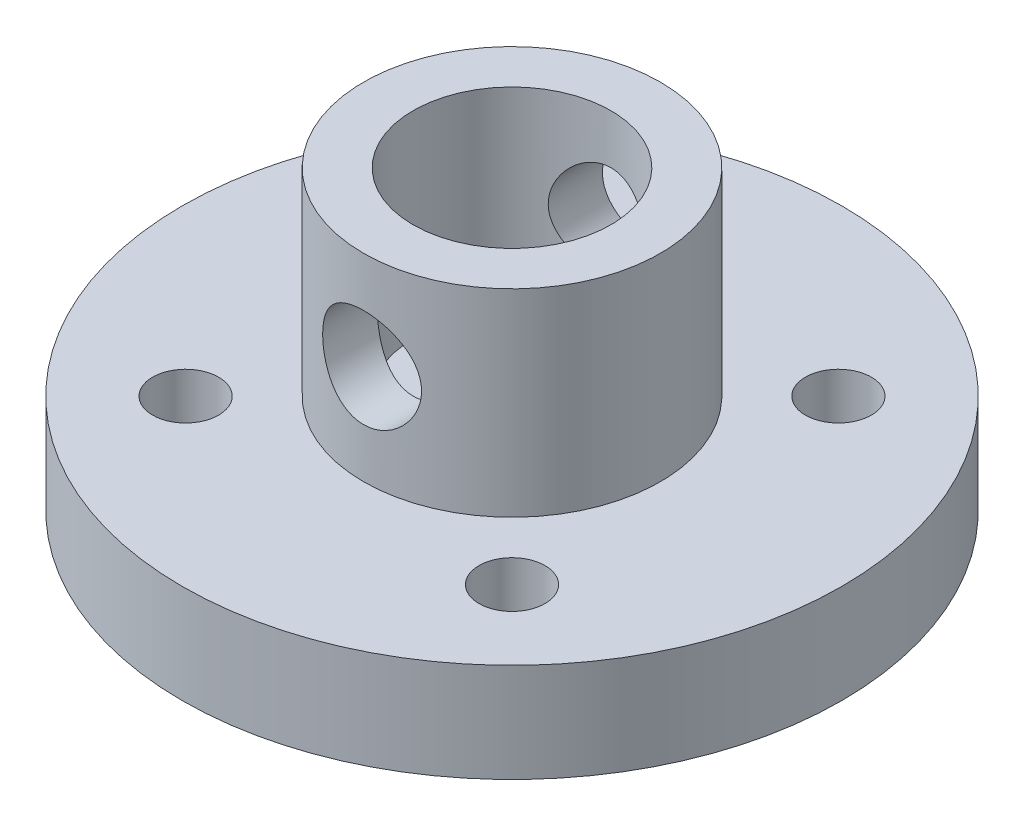
from build123d import *

# Parameters (mm, degrees)
CROQUIS1_R                 = 10
CROQUIS1_R_2               = 1
SALIENTE_EXTRUIR1_DEPTH    = 3
SALIENTE_EXTRUIR2_START    = 3
CROQUIS1_3_R               = 4.5
CROQUIS1_3_R_2             = 3
SALIENTE_EXTRUIR2_DEPTH    = 6
CORTAR_EXTRUIR1_DEPTH      = 17.763054614
CORTAR_EXTRUIR1_DEPTH_BACK = 17.763054614
CROQUIS2_R                 = 1.5


with BuildPart() as part:
    # Croquis1 → Saliente-Extruir1 (new body)
    with BuildSketch(Plane(origin=(0, 0, 0), x_dir=(1, 0, 0), z_dir=(0, 1, 0))):
        with Locations(Location((0, 0, 0), (0, 0, 270))):
            Circle(CROQUIS1_R)
        with Locations(Location((-4.949747468, 4.949747468, 0), (0, 0, 270))):
            Circle(CROQUIS1_R_2, mode=Mode.SUBTRACT)
        with Locations(Location((4.949747468, 4.949747468, 0), (0, 0, 270))):
            Circle(CROQUIS1_R_2, mode=Mode.SUBTRACT)
        with Locations(Location((4.949747468, -4.949747468, 0), (0, 0, 270))):
            Circle(CROQUIS1_R_2, mode=Mode.SUBTRACT)
        with Locations(Location((-4.949747468, -4.949747468, 0), (0, 0, 270))):
            Circle(CROQUIS1_R_2, mode=Mode.SUBTRACT)
    extrude(amount=SALIENTE_EXTRUIR1_DEPTH)

    # Croquis1<3> → Saliente-Extruir2 (add)
    with BuildSketch(Plane(origin=(0, 0, 0), x_dir=(1, 0, 0), z_dir=(0, 1, 0)).offset(SALIENTE_EXTRUIR2_START)):
        with Locations(Location((0, 0, 0), (0, 0, 270))):
            Circle(CROQUIS1_3_R)
        with Locations(Location((0, 0, 0), (0, 0, 270))):
            Circle(CROQUIS1_3_R_2, mode=Mode.SUBTRACT)
    extrude(amount=SALIENTE_EXTRUIR2_DEPTH)

    # Croquis2 → Cortar-Extruir1 (cut, two sides: drawn at the far end of the back side and taken through both)
    with BuildSketch(Plane.XY.offset(-CORTAR_EXTRUIR1_DEPTH_BACK)):
        with Locations((0, 6)):
            Circle(CROQUIS2_R)
    extrude(amount=CORTAR_EXTRUIR1_DEPTH + CORTAR_EXTRUIR1_DEPTH_BACK, mode=Mode.SUBTRACT)


solid = part.part
